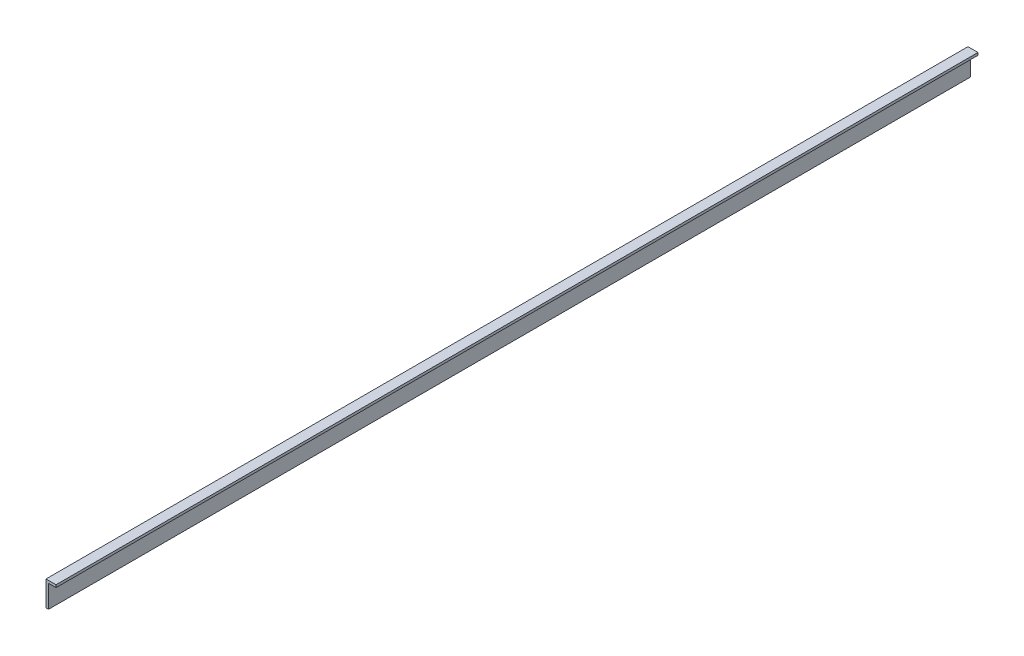
from build123d import *

# Parameters (mm, degrees)
STORE_KASET_L_RAF_4_SOL_1_START = -20
STORE_KASET_L_RAF_4_SOL_1_DEPTH = 735.5


with BuildPart() as part:
    # Sketch1 → STORE_kaset_L_raf_4_sol_1 (new body)
    with BuildSketch(Plane.XY.offset(STORE_KASET_L_RAF_4_SOL_1_START)):
        Polygon((541.5, 404.5), (539.5, 404.5), (539.5, 424.5), (547.5, 424.5), (547.5, 422.5), (541.5, 422.5), align=None)
    extrude(amount=-STORE_KASET_L_RAF_4_SOL_1_DEPTH)


solid = part.part
